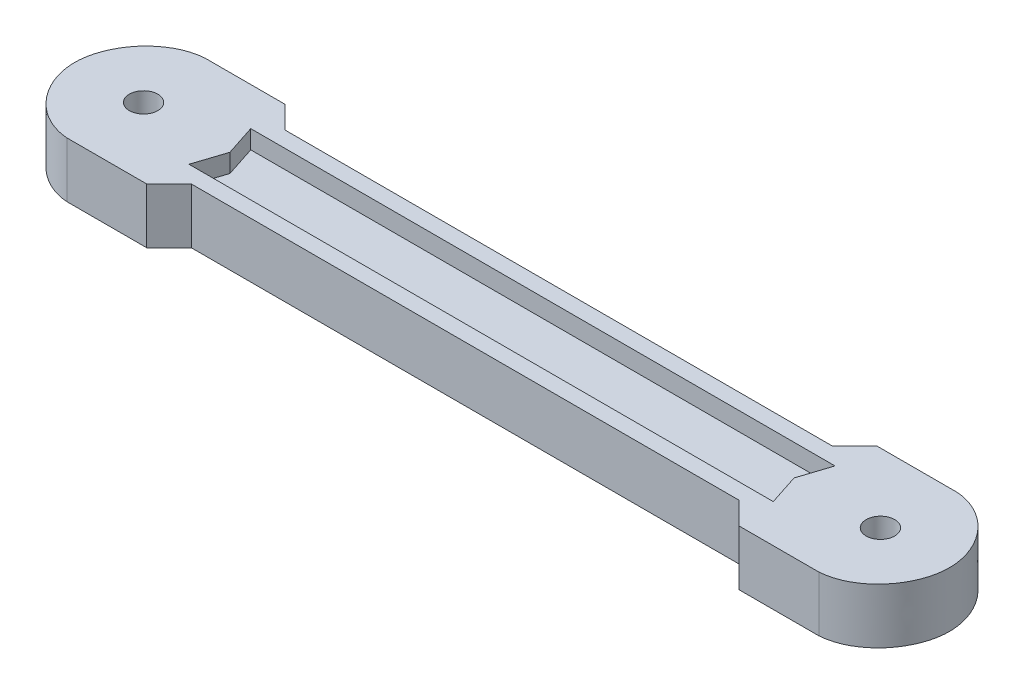
from build123d import *

# Parameters (mm, degrees)
ESQUISSE1_W             = 95
ESQUISSE1_H             = 15
BOSS_EXTRU_1_DEPTH      = 6
ESQUISSE4_W             = 110.64112288
ESQUISSE4_H             = 30
ENL_V_MAT_EXTRU_1_DEPTH = 12
ESQUISSE3_R             = 1.55
ENL_V_MAT_EXTRU_2_DEPTH = 12
ENL_V_MAT_EXTRU_3_DEPTH = 2


with BuildPart() as part:
    # Esquisse1 → Boss.-Extru.1 (new body)
    with BuildSketch(Plane(origin=(0, 0, 0), x_dir=(1, 0, 0), z_dir=(0, 1, 0))):
        Rectangle(ESQUISSE1_W, ESQUISSE1_H)
    extrude(amount=BOSS_EXTRU_1_DEPTH)

    # Esquisse4 → Enlèv. mat.-Extru.1 (cut)
    with BuildSketch(Plane(origin=(0, 6, 0), x_dir=(1, 0, 0), z_dir=(0, 1, 0))):
        Rectangle(ESQUISSE4_W, ESQUISSE4_H)
        with BuildLine():
            Line((-32.159158072, 7.5), (-29.738516234, 5.079358161))
            Line((-29.738516234, 5.079358161), (29.738516234, 5.079358161))
            Line((29.738516234, 5.079358161), (32.159158072, 7.5))
            Line((32.159158072, 7.5), (40, 7.5))
            add(Edge.make_bspline(
                [(40, 7.5), (44.08518124, 7.773957054), (50.914818759, -1e-09), (44.085181242, -7.773957053), (40, -7.5)],
                knots=[0, 0, 0, 0, 0.5, 1, 1, 1, 1], degree=3))
            Line((40, -7.5), (32.159158072, -7.5))
            Line((32.159158072, -7.5), (29.738516234, -5.079358161))
            Line((29.738516234, -5.079358161), (-29.738516234, -5.079358161))
            Line((-29.738516234, -5.079358161), (-32.159158072, -7.5))
            Line((-32.159158072, -7.5), (-40, -7.5))
            add(Edge.make_bspline(
                [(-40, 7.5), (-44.08518124, 7.773957054), (-50.914818759, -1e-09), (-44.085181242, -7.773957053), (-40, -7.5)],
                knots=[0, 0, 0, 0, 0.5, 1, 1, 1, 1], degree=3))
            Line((-40, 7.5), (-32.159158072, 7.5))
        make_face(mode=Mode.SUBTRACT)
    extrude(amount=-ENL_V_MAT_EXTRU_1_DEPTH, mode=Mode.SUBTRACT)

    # Esquisse3 → Enlèv. mat.-Extru.2 (cut)
    with BuildSketch(Plane.XZ):
        with Locations(Location((-40, 0, 0), (0, 0, 270))):
            Circle(ESQUISSE3_R)
        with Locations(Location((40, 0, 0), (0, 0, 270))):
            Circle(ESQUISSE3_R)
    extrude(amount=-ENL_V_MAT_EXTRU_2_DEPTH, mode=Mode.SUBTRACT)

    # Esquisse5 → Enlèv. mat.-Extru.3 (cut)
    with BuildSketch(Plane(origin=(0, 6, 0), x_dir=(1, 0, 0), z_dir=(0, 1, 0))):
        Polygon((-30.624952607, 0), (-31.717415088, 3.351936497), (31.717415088, 3.351936497), (30.624952607, 0), (31.717415088, -3.351936497), (-31.717415088, -3.351936497), align=None)
    extrude(amount=-ENL_V_MAT_EXTRU_3_DEPTH, mode=Mode.SUBTRACT)


solid = part.part
